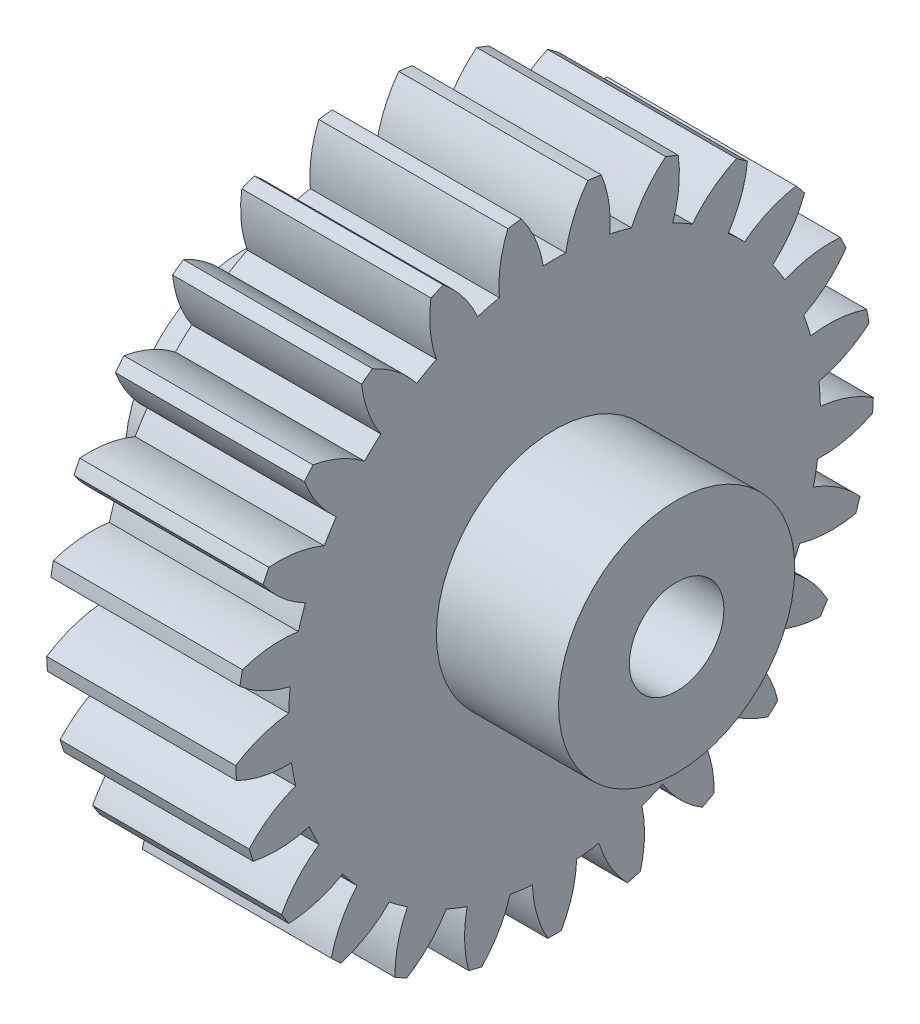
from build123d import *

# Parameters (mm, degrees)
BASPROSKE_W        = 12
BASPROSKE_H        = 20.25
TOOTHCUT_DEPTH     = 32.050362317
TEETHCUTS_COUNT    = 25
TEETHCUTS_ANGLE    = 345.6
HUBNEABOTSKE_R     = 7.5
HUBNEARBOTH_DEPTH  = 7.7500254
HUBFAR_START       = 7.7500254
HUBFARSKE_R        = 7.5
HUBFAR_DEPTH       = 7.7500254
BORSKE_R           = 3
BORE_DEPTH         = 27.5000508
SKETCH1_R          = 2
CUT_EXTRUDE1_DEPTH = 15


with BuildPart() as part:
    # BasProSke → Base-Revolve (revolve)
    with BuildSketch(Plane(origin=(0, 0, 0), x_dir=(1, 0, 0), z_dir=(0, 1, 0)), mode=Mode.PRIVATE) as base_revolve_sk:
        with Locations((6, 10.125)):
            Rectangle(BASPROSKE_W, BASPROSKE_H)
    revolve(base_revolve_sk.sketch.rotate(Axis((-10, 0, 0), (1, 0, 0)), 180), axis=Axis((-10, 0, 0), (1, 0, 0)))

    # TooCutSke → ToothCut (cut, through all)
    with BuildSketch(Plane(origin=(0, 0, 0), x_dir=(0, 0, -1), z_dir=(1, 0, 0))):
        with BuildLine():
            ThreePointArc((0.713909619, 16.858891098), (0, 16.874), (-0.713909619, 16.858891098))
            ThreePointArc((-0.713909619, 16.858891098), (-1.221902209, 18.597177626), (-2.131751691, 20.163022588))
            ThreePointArc((-2.131751691, 20.163022588), (0, 20.2754), (2.131751691, 20.163022588))
            ThreePointArc((2.131751691, 20.163022588), (1.221902209, 18.597177626), (0.713909619, 16.858891098))
        make_face()
    toothcut = extrude(amount=TOOTHCUT_DEPTH, mode=Mode.SUBTRACT)

    # TeethCuts: ToothCut ×25 about axis
    teethcuts_axis = Axis((-10, 0, 0), (1, 0, 0))
    for i in range(1, TEETHCUTS_COUNT):
        add(toothcut.rotate(teethcuts_axis, i * TEETHCUTS_ANGLE / (TEETHCUTS_COUNT - 1)), mode=Mode.SUBTRACT)

    # HubNeaBotSke → HubNearBoth (add)
    with BuildSketch(Plane.ZY):
        with Locations(Location((0, 0, 0), (0, 0, 180))):
            Circle(HUBNEABOTSKE_R)
    extrude(amount=HUBNEARBOTH_DEPTH)

    # HubFarSke → HubFar (add)
    with BuildSketch(Plane(origin=(12, 0, 0), x_dir=(0, 0, -1), z_dir=(1, 0, 0)).offset(HUBFAR_START)):
        Circle(HUBFARSKE_R)
    extrude(amount=-HUBFAR_DEPTH)

    # BorSke → Bore (cut, symmetric)
    with BuildSketch(Plane(origin=(0, 0, 0), x_dir=(0, 0, -1), z_dir=(1, 0, 0))):
        with Locations(Location((0, 0, 0), (0, 0, 180))):
            Circle(BORSKE_R)
    extrude(amount=BORE_DEPTH, both=True, mode=Mode.SUBTRACT)

    # Sketch1 → Cut-Extrude1 (cut)
    with BuildSketch(Plane.ZY):
        with Locations((-8.700018149, -7.520617276)):
            Circle(SKETCH1_R)
    extrude(amount=-CUT_EXTRUDE1_DEPTH, mode=Mode.SUBTRACT)


solid = part.part
